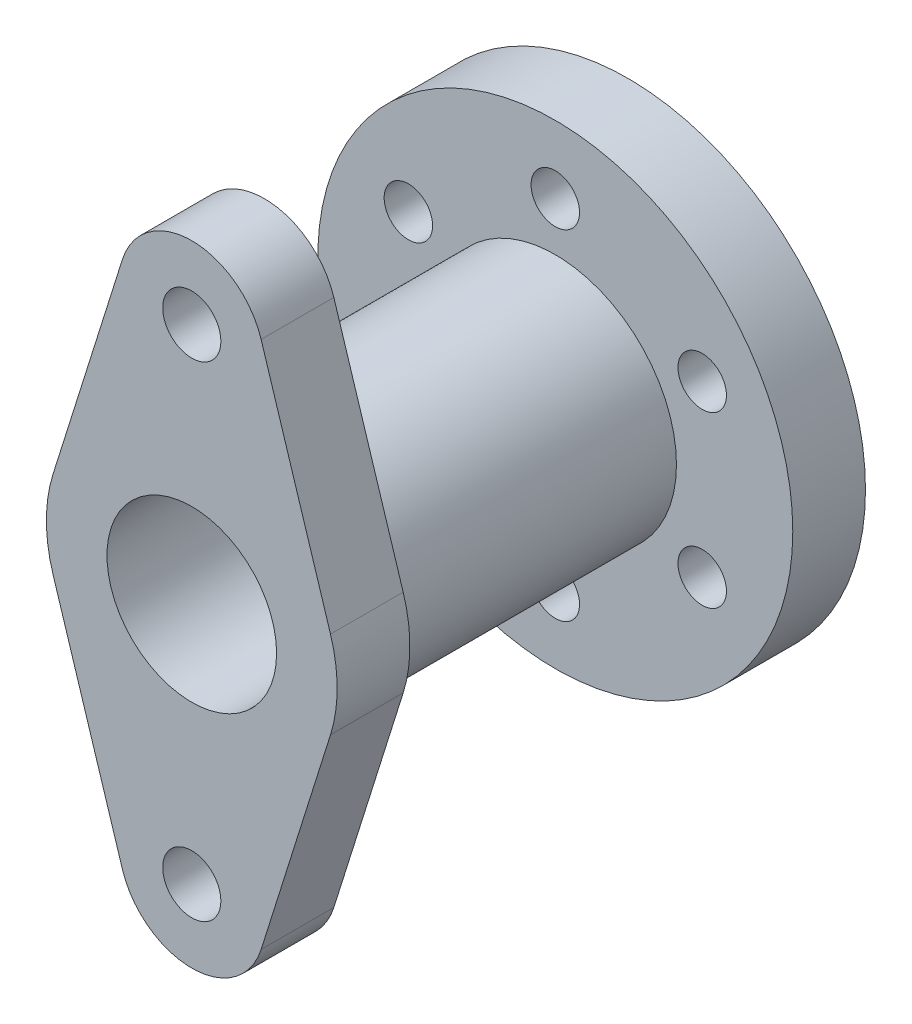
from build123d import *

# Parameters (mm, degrees)
CROQUIS1_R              = 49
SALIENTE_EXTRUIR1_DEPTH = 15
CROQUIS2_R              = 5
CORTAR_EXTRUIR1_DEPTH   = 71.901339903
CROQUIS3_R              = 25
CROQUIS3_R_2            = 13
SALIENTE_EXTRUIR2_DEPTH = 75
CROQUIS4_R              = 6
SALIENTE_EXTRUIR3_DEPTH = 15
CROQUIS5_R              = 17.5
CORTAR_EXTRUIR2_DEPTH   = 30


with BuildPart() as part:
    # Croquis1 → Saliente-Extruir1 (new body)
    with BuildSketch(Plane.XY):
        Circle(CROQUIS1_R)
    extrude(amount=SALIENTE_EXTRUIR1_DEPTH)

    # Croquis2 → Cortar-Extruir1 (cut, through all)
    with BuildSketch(Plane.XY.offset(15)):
        with Locations((0, 35)):
            Circle(CROQUIS2_R)
        with Locations((30.310889132, 17.5)):
            Circle(CROQUIS2_R)
        with Locations((30.310889132, -17.5)):
            Circle(CROQUIS2_R)
        with Locations((0, -35)):
            Circle(CROQUIS2_R)
        with Locations((-30.310889132, -17.5)):
            Circle(CROQUIS2_R)
        with Locations((-30.310889132, 17.5)):
            Circle(CROQUIS2_R)
    extrude(amount=-CORTAR_EXTRUIR1_DEPTH, mode=Mode.SUBTRACT)

    # Croquis3 → Saliente-Extruir2 (add)
    with BuildSketch(Plane.XY.offset(15)):
        Circle(CROQUIS3_R)
        Circle(CROQUIS3_R_2, mode=Mode.SUBTRACT)
    extrude(amount=SALIENTE_EXTRUIR2_DEPTH)

    # Croquis4 → Saliente-Extruir3 (add)
    with BuildSketch(Plane.XY.offset(90)):
        with BuildLine():
            Line((14.309088021, 54.5), (28.618176043, 9))
            ThreePointArc((28.618176043, 9), (30, 0), (28.618176043, -9))
            Line((28.618176043, -9), (14.309088021, -54.5))
            ThreePointArc((14.309088021, -54.5), (0, -65), (-14.309088021, -54.5))
            Line((-14.309088021, -54.5), (-28.618176043, -9))
            ThreePointArc((-28.618176043, -9), (-30, 0), (-28.618176043, 9))
            Line((-28.618176043, 9), (-14.309088021, 54.5))
            ThreePointArc((-14.309088021, 54.5), (0, 65), (14.309088021, 54.5))
        make_face()
        with Locations((0, 50)):
            Circle(CROQUIS4_R, mode=Mode.SUBTRACT)
        with Locations((0, -50)):
            Circle(CROQUIS4_R, mode=Mode.SUBTRACT)
    extrude(amount=-SALIENTE_EXTRUIR3_DEPTH)

    # Croquis5 → Cortar-Extruir2 (cut)
    with BuildSketch(Plane.XY.offset(90)):
        Circle(CROQUIS5_R)
    extrude(amount=-CORTAR_EXTRUIR2_DEPTH, mode=Mode.SUBTRACT)


solid = part.part
